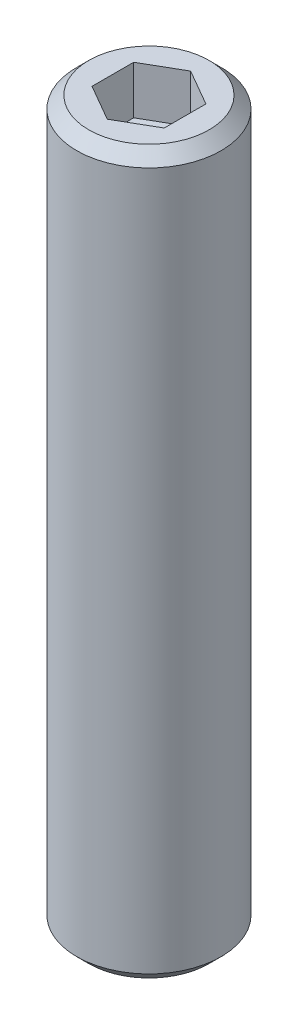
from build123d import *

# Parameters (mm, degrees)
SKETCH1_R           = 3
BOSS_EXTRUDE1_DEPTH = 30
CUT_EXTRUDE1_DEPTH  = 2
CHAMFER1_SIZE       = 0.5


with BuildPart() as part:
    # Sketch1 → Boss-Extrude1 (new body)
    with BuildSketch(Plane(origin=(0, 0, 0), x_dir=(1, 0, 0), z_dir=(0, 1, 0))):
        with Locations(Location((0, 0, 0), (0, 0, 270))):
            Circle(SKETCH1_R)
    extrude(amount=-BOSS_EXTRUDE1_DEPTH)

    # Sketch2 → Cut-Extrude1 (cut)
    with BuildSketch(Plane(origin=(0, 0, 0), x_dir=(1, 0, 0), z_dir=(0, 1, 0))):
        Polygon((0, 1.732050808), (-1.5, 0.866025404), (-1.5, -0.866025404), (0, -1.732050808), (1.5, -0.866025404), (1.5, 0.866025404), align=None)
    extrude(amount=-CUT_EXTRUDE1_DEPTH, mode=Mode.SUBTRACT)

    # Chamfer1
    chamfer1_edges = [part.edges().sort_by_distance(p)[0] for p in [
        (0, 0, -3),
        (0, -30, -3),
    ]]
    chamfer(chamfer1_edges, length=CHAMFER1_SIZE)


solid = part.part
